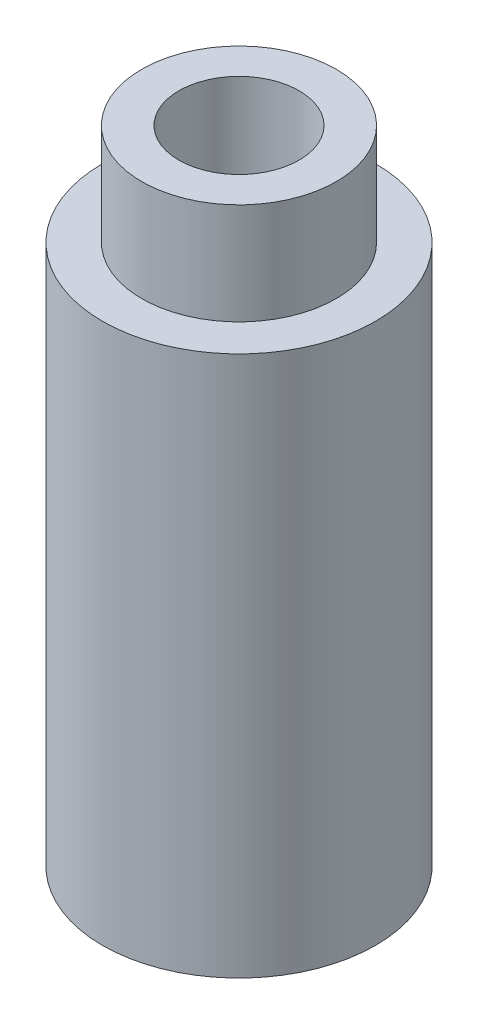
from build123d import *

# Parameters (mm, degrees)
SKETCH1_R           = 12.827
BOSS_EXTRUDE1_DEPTH = 50.8
SKETCH2_R           = 9.144
BOSS_EXTRUDE2_DEPTH = 9.525
SKETCH3_R           = 5.6515
CUT_EXTRUDE1_DEPTH  = 59.69


with BuildPart() as part:
    # Sketch1 → Boss-Extrude1 (new body)
    with BuildSketch(Plane(origin=(0, 0, 0), x_dir=(1, 0, 0), z_dir=(0, 1, 0))):
        with Locations(Location((0, 0, 0), (0, 0, 270))):
            Circle(SKETCH1_R)
    extrude(amount=BOSS_EXTRUDE1_DEPTH)

    # Sketch2 → Boss-Extrude2 (add)
    with BuildSketch(Plane(origin=(0, 50.8, 0), x_dir=(1, 0, 0), z_dir=(0, 1, 0))):
        with Locations(Location((0, 0, 0), (0, 0, 90))):
            Circle(SKETCH2_R)
    extrude(amount=BOSS_EXTRUDE2_DEPTH)

    # Sketch3 → Cut-Extrude1 (cut)
    with BuildSketch(Plane(origin=(0, 60.325, 0), x_dir=(1, 0, 0), z_dir=(0, 1, 0))):
        with Locations(Location((0, 0, 0), (0, 0, 270))):
            Circle(SKETCH3_R)
    extrude(amount=-CUT_EXTRUDE1_DEPTH, mode=Mode.SUBTRACT)


solid = part.part
